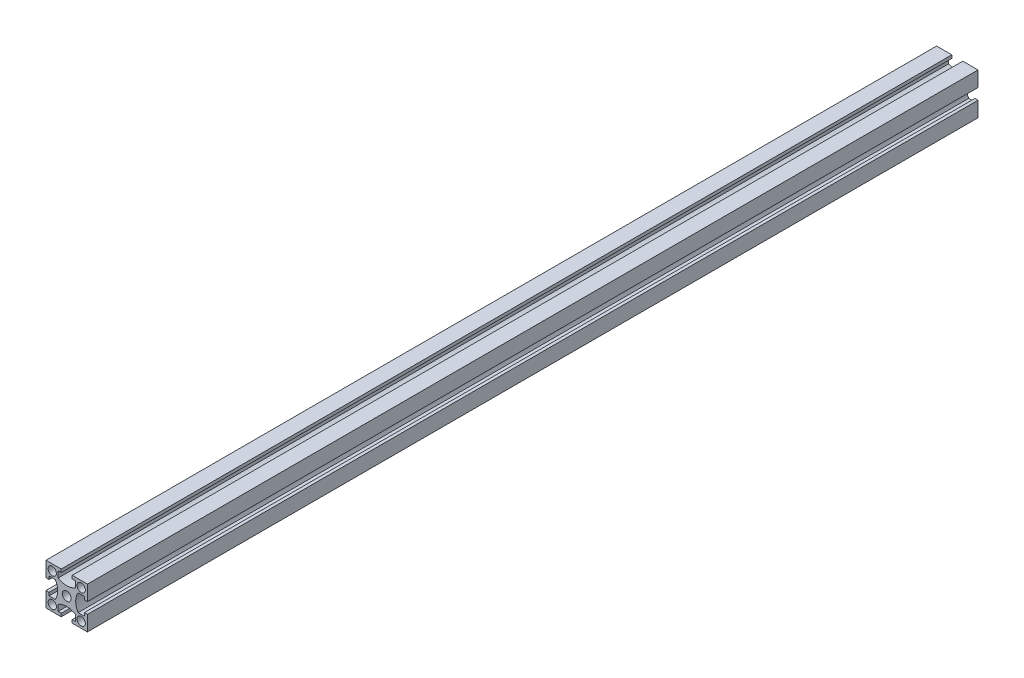
from build123d import *

# Parameters (mm, degrees)
SKETCH_1_W          = 20
SKETCH_1_H          = 20
EXTRUDE_1_DEPTH     = 430
SKETCH_2_R          = 2.15
SKETCH_2_R_2        = 2
CUT_EXTRUDE_1_DEPTH = 431.232495286


with BuildPart() as part:
    # 스케치1 → 보스-돌출1 (new body)
    with BuildSketch(Plane.XY):
        Rectangle(SKETCH_1_W, SKETCH_1_H)
    extrude(amount=EXTRUDE_1_DEPTH)

    # 스케치2 → 컷-돌출1 (cut, through all)
    with BuildSketch(Plane.XY.offset(430)):
        Circle(SKETCH_2_R)
        with Locations((-7, 7)):
            Circle(SKETCH_2_R_2)
        with Locations((7, 7)):
            Circle(SKETCH_2_R_2)
        with Locations((7, -7)):
            Circle(SKETCH_2_R_2)
        with Locations((-7, -7)):
            Circle(SKETCH_2_R_2)
        with BuildLine():
            Line((-2.65, 10), (-2.65, 8.5))
            Line((-2.65, 8.5), (-4.15, 8.5))
            Line((-4.15, 8.5), (-4.15, 5.5))
            ThreePointArc((-4.15, 5.5), (0, 4.339407869), (4.15, 5.5))
            Line((4.15, 5.5), (4.15, 8.5))
            Line((4.15, 8.5), (2.65, 8.5))
            Line((2.65, 8.5), (2.65, 10))
            Line((2.65, 10), (-2.65, 10))
        make_face()
        with BuildLine():
            Line((10, 2.65), (8.5, 2.65))
            Line((8.5, 2.65), (8.5, 4.15))
            Line((8.5, 4.15), (5.5, 4.15))
            ThreePointArc((5.5, 4.15), (4.339407869, 0), (5.5, -4.15))
            Line((5.5, -4.15), (8.5, -4.15))
            Line((8.5, -4.15), (8.5, -2.65))
            Line((8.5, -2.65), (10, -2.65))
            Line((10, -2.65), (10, 2.65))
        make_face()
        with BuildLine():
            Line((2.65, -10), (2.65, -8.5))
            Line((2.65, -8.5), (4.15, -8.5))
            Line((4.15, -8.5), (4.15, -5.5))
            ThreePointArc((4.15, -5.5), (0, -4.339407869), (-4.15, -5.5))
            Line((-4.15, -5.5), (-4.15, -8.5))
            Line((-4.15, -8.5), (-2.65, -8.5))
            Line((-2.65, -8.5), (-2.65, -10))
            Line((-2.65, -10), (2.65, -10))
        make_face()
        with BuildLine():
            Line((-10, -2.65), (-8.5, -2.65))
            Line((-8.5, -2.65), (-8.5, -4.15))
            Line((-8.5, -4.15), (-5.5, -4.15))
            ThreePointArc((-5.5, -4.15), (-4.339407869, 0), (-5.5, 4.15))
            Line((-5.5, 4.15), (-8.5, 4.15))
            Line((-8.5, 4.15), (-8.5, 2.65))
            Line((-8.5, 2.65), (-10, 2.65))
            Line((-10, 2.65), (-10, -2.65))
        make_face()
    extrude(amount=-CUT_EXTRUDE_1_DEPTH, mode=Mode.SUBTRACT)


solid = part.part
